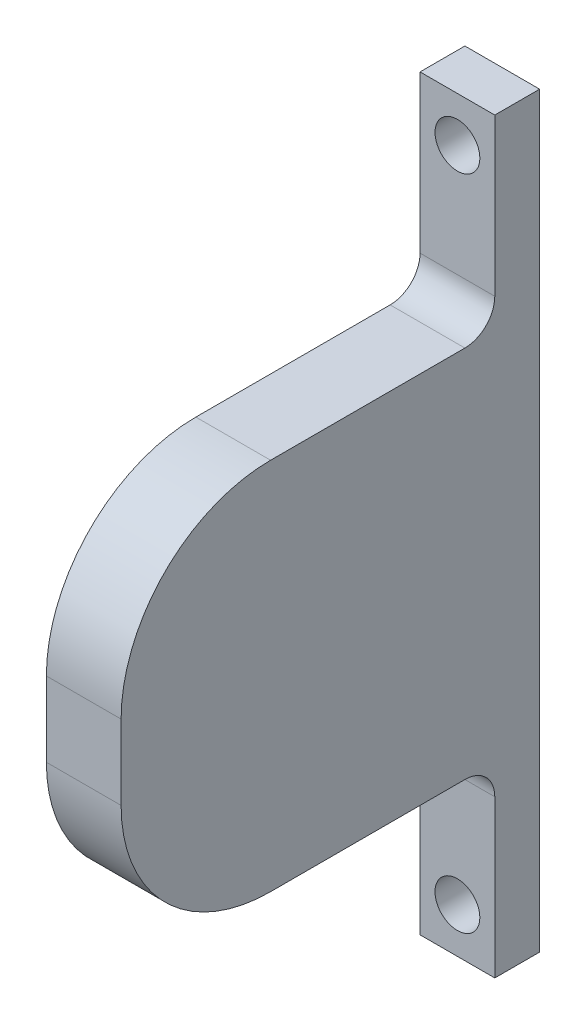
from build123d import *

# Parameters (mm, degrees)
EXTRUDE_2_DEPTH     = 5
SKETCH_2_R          = 1.5
CUT_EXTRUDE_1_DEPTH = 4
SKETCH_3_R          = 5.05
CUT_EXTRUDE_2_DEPTH = 3
CHAMFER_1_SIZE      = 0.5
FILLET_1_R          = 10
FILLET_2_R          = 2


with BuildPart() as part:
    # 草图1 → 凸台-拉伸2 (new body)
    with BuildSketch(Plane(origin=(0, 0, 0), x_dir=(0, 0, -1), z_dir=(1, 0, 0))):
        Polygon((25, 25), (25, 37.5), (28, 37.5), (28, -12.5), (25, -12.5), (25, 0), (0, 0), (0, 25), align=None)
    extrude(amount=EXTRUDE_2_DEPTH)

    # 草图2 → 切除-拉伸1 (cut)
    with BuildSketch(Plane.XY.offset(-25)):
        with Locations((2.5, 34.5)):
            Circle(SKETCH_2_R)
        with Locations((2.5, -9.5)):
            Circle(SKETCH_2_R)
    extrude(amount=-CUT_EXTRUDE_1_DEPTH, mode=Mode.SUBTRACT)

    # 草图3 → 切除-拉伸2 (cut)
    with BuildSketch(Plane.ZY):
        with Locations((-8, 12.5)):
            Circle(SKETCH_3_R)
    extrude(amount=-CUT_EXTRUDE_2_DEPTH, mode=Mode.SUBTRACT)

    # 倒角1
    chamfer_1_edges = [part.edges().sort_by_distance(p)[0] for p in [
        (0, 12.5, -13.05),
    ]]
    chamfer(chamfer_1_edges, length=CHAMFER_1_SIZE)

    # 圆角1
    fillet_1_edges = [part.edges().sort_by_distance(p)[0] for p in [
        (2.5, 25, 0),
        (2.5, 0, 0),
    ]]
    fillet(fillet_1_edges, radius=FILLET_1_R)

    # 圆角2
    fillet_2_edges = [part.edges().sort_by_distance(p)[0] for p in [
        (2.5, 25, -25),
        (2.5, 0, -25),
    ]]
    fillet(fillet_2_edges, radius=FILLET_2_R)


solid = part.part
